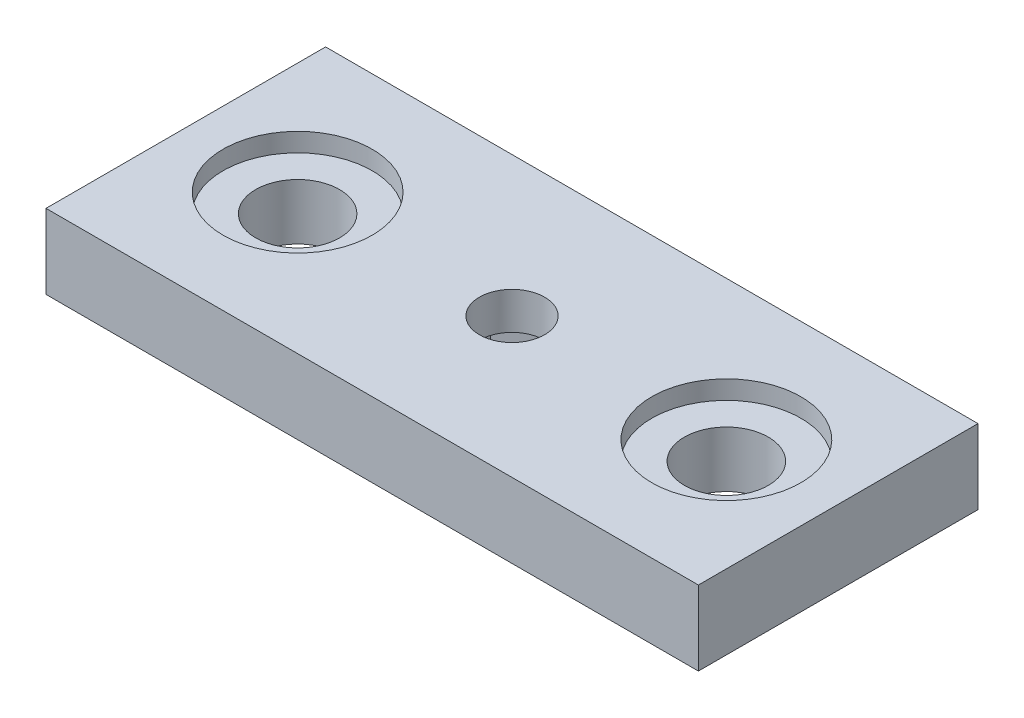
from build123d import *

# Parameters (mm, degrees)
SKETCH_1_W                = 35
SKETCH_1_H                = 15
EXTRUDE_1_DEPTH           = 4
HOLE_WIZARD_3_5_3_5_1_D   = 3.5
HOLE_WIZARD_1_D           = 4.5
HOLE_WIZARD_1_CBORE_D     = 8
HOLE_WIZARD_1_CBORE_DEPTH = 1
CUT_EXTRUDE_1_DEPTH       = 2


with BuildPart() as part:
    # 草圖1 → 填料-伸長1 (new body)
    with BuildSketch(Plane(origin=(0, 0, 0), x_dir=(1, 0, 0), z_dir=(0, 1, 0))):
        with Locations((17.5, 7.5)):
            Rectangle(SKETCH_1_W, SKETCH_1_H)
    extrude(amount=EXTRUDE_1_DEPTH)

    # Ø3.5 (3.5) 直徑孔1 (through all)
    with Locations(Plane(origin=(0, 4, 0), x_dir=(1, 0, 0), z_dir=(0, 1, 0))):
        with Locations((17.5, 7.5)):
            Hole(HOLE_WIZARD_3_5_3_5_1_D / 2)

    # 鑽孔1 (through all)
    with Locations(Plane(origin=(0, 4, 0), x_dir=(1, 0, 0), z_dir=(0, 1, 0))):
        with Locations((6, 7.5), (29, 7.5)):
            CounterBoreHole(HOLE_WIZARD_1_D / 2, HOLE_WIZARD_1_CBORE_D / 2, HOLE_WIZARD_1_CBORE_DEPTH)

    # 草圖8 → 除料-伸長1 (cut)
    with BuildSketch(Plane.XZ):
        Polygon((17.5, -10.675426481), (20.25, -9.08771324), (20.25, -5.91228676), (17.5, -4.324573519), (14.75, -5.91228676), (14.75, -9.08771324), align=None)
    extrude(amount=-CUT_EXTRUDE_1_DEPTH, mode=Mode.SUBTRACT)


solid = part.part
